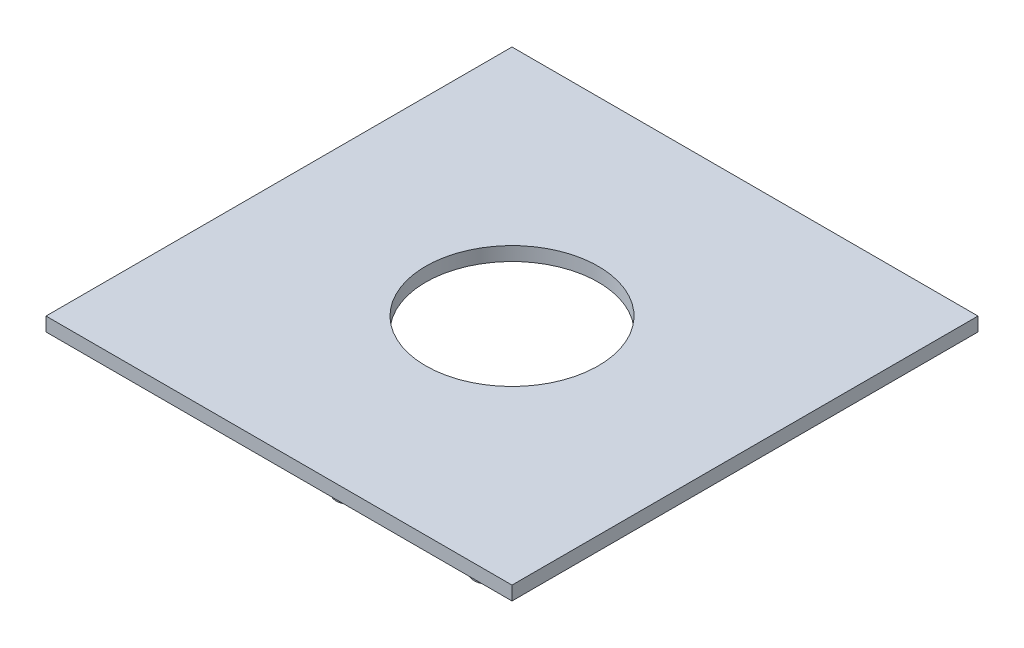
from build123d import *

# Parameters (mm, degrees)
SKETCH1_W           = 135
SKETCH1_H           = 135
BOSS_EXTRUDE1_DEPTH = 4
SKETCH1_3_R         = 3.9
BOSS_EXTRUDE2_DEPTH = 4.5
SKETCH2_R           = 25
CUT_EXTRUDE1_DEPTH  = 10


with BuildPart() as part:
    # Sketch1 → Boss-Extrude1 (new body)
    with BuildSketch(Plane(origin=(0, 0, 0), x_dir=(1, 0, 0), z_dir=(0, 1, 0))):
        Rectangle(SKETCH1_W, SKETCH1_H)
    extrude(amount=BOSS_EXTRUDE1_DEPTH)

    # Sketch1<3> → Boss-Extrude2 (add)
    with BuildSketch(Plane(origin=(0, 0, 0), x_dir=(1, 0, 0), z_dir=(0, 1, 0))):
        with Locations((12.5, -59.5)):
            Circle(SKETCH1_3_R)
        with Locations((52.5, -59.5)):
            Circle(SKETCH1_3_R)
    extrude(amount=-BOSS_EXTRUDE2_DEPTH)

    # Sketch2 → Cut-Extrude1 (cut)
    with BuildSketch(Plane(origin=(0, 4, 0), x_dir=(1, 0, 0), z_dir=(0, 1, 0))):
        Circle(SKETCH2_R)
    extrude(amount=-CUT_EXTRUDE1_DEPTH, mode=Mode.SUBTRACT)


solid = part.part
